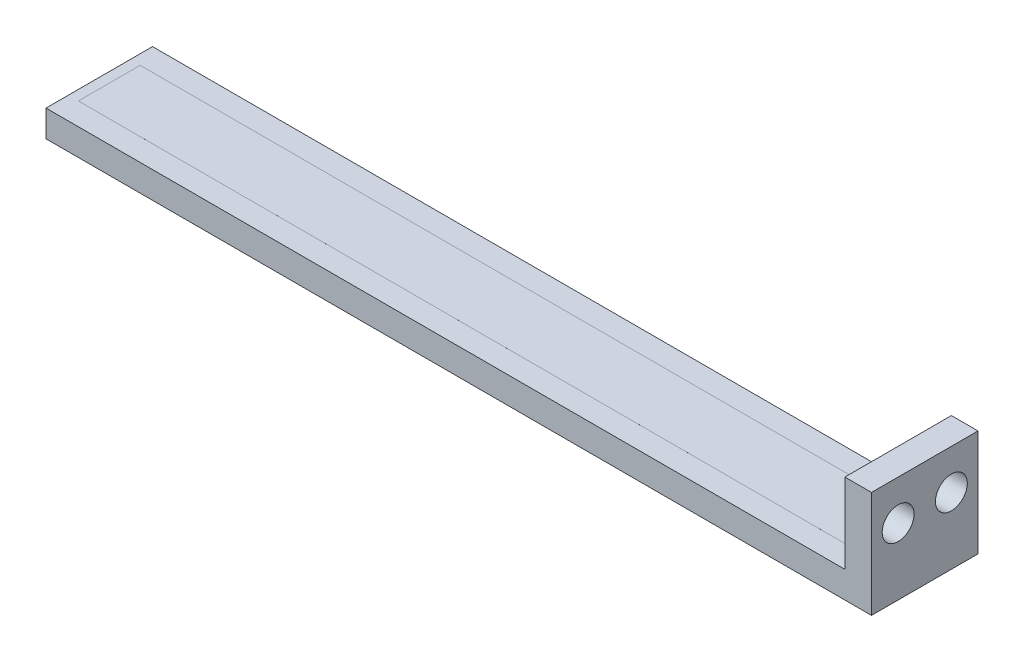
from build123d import *

# Parameters (mm, degrees)
BOSS_EXTRUDE1_DEPTH = 12.7
SKETCH2_R           = 1.89865
CUT_EXTRUDE1_DEPTH  = 12.7
SKETCH3_W           = 92.857106726
SKETCH3_H           = 7.363806504
BOSS_EXTRUDE2_DEPTH = 0.000254


with BuildPart() as part:
    # Sketch1 → Boss-Extrude1 (new body)
    with BuildSketch(Plane.XY):
        Polygon((-47.625, -1.5875), (50.8, -1.5875), (50.8, 11.1125), (47.625, 11.1125), (47.625, 1.5875), (-47.625, 1.5875), align=None)
    extrude(amount=BOSS_EXTRUDE1_DEPTH)

    # Sketch2 → Cut-Extrude1 (cut)
    with BuildSketch(Plane.ZY.offset(-47.625)):
        with Locations((3.175, 6.35)):
            Circle(SKETCH2_R)
        with Locations((9.525, 6.35)):
            Circle(SKETCH2_R)
    extrude(amount=-CUT_EXTRUDE1_DEPTH, mode=Mode.SUBTRACT)

    # Sketch3 → Boss-Extrude2 (add)
    with BuildSketch(Plane(origin=(0, 1.5875, 0), x_dir=(1, 0, 0), z_dir=(0, 1, 0))):
        with Locations((0, -6.35)):
            Rectangle(SKETCH3_W, SKETCH3_H)
    extrude(amount=BOSS_EXTRUDE2_DEPTH)


solid = part.part
